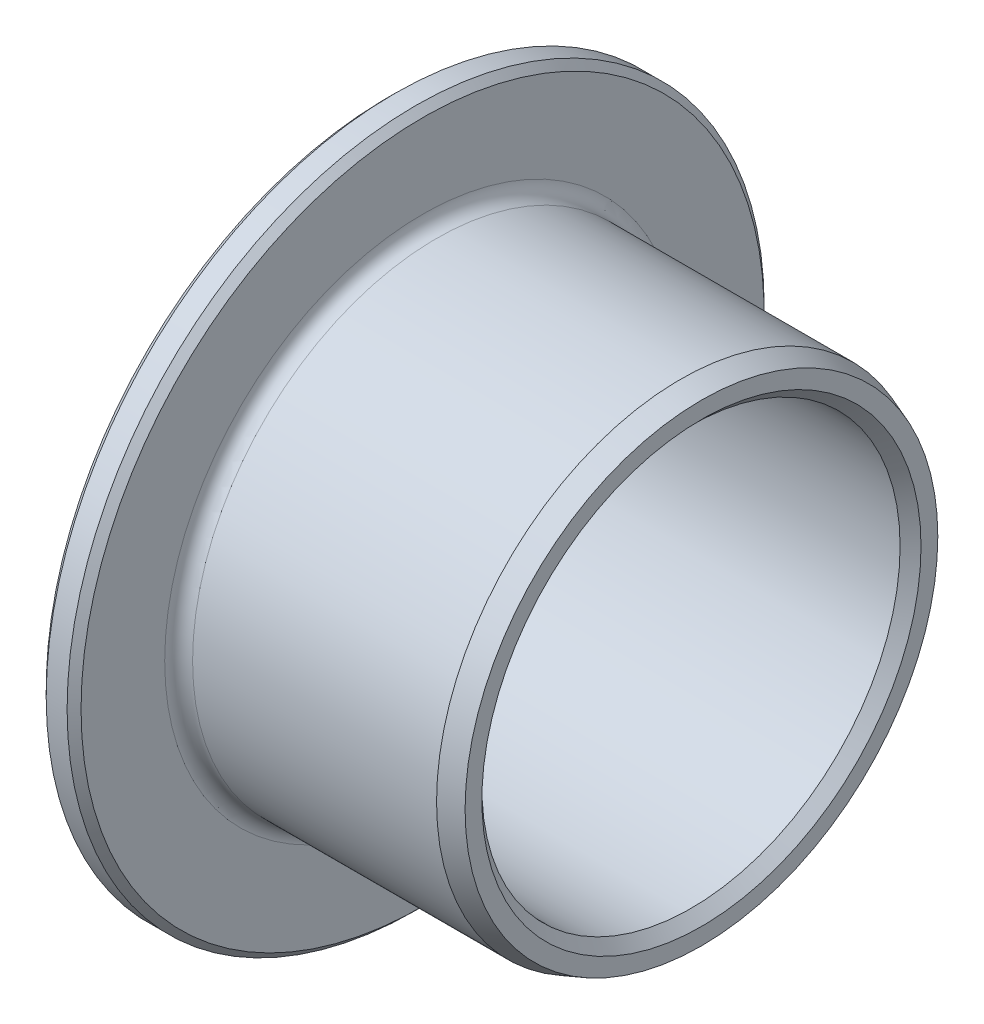
from build123d import *

# Parameters (mm, degrees)
CHANFREIN2_SIZE  = 0.6
CHANFREIN2_SIZE2 = 0.218382141
CHANFREIN3_SIZE  = 0.3
CHANFREIN4_SIZE  = 0.2
CONG_1_R         = 0.4


with BuildPart() as part:
    # Esquisse1 → Base-Révolution (revolve)
    with BuildSketch(Plane.XY, mode=Mode.PRIVATE) as base_r_volution_sk:
        Polygon((-1, 6), (-1, 10), (0, 10), (0, 7), (8, 7), (8, 6), align=None)
    revolve(base_r_volution_sk.sketch.rotate(Axis((-5.312682662, 0, 0), (1, 0, 0)), 90), axis=Axis((-5.312682662, 0, 0), (1, 0, 0)))

    # Chanfrein2
    chanfrein2_edges = [part.edges().sort_by_distance(p)[0] for p in [
        (8, 0, -7),
    ]]
    chanfrein2_side = [part.faces().sort_by_distance(p)[0] for p in [
        (4, 0, -7),
    ]]
    chamfer(chanfrein2_edges, length=CHANFREIN2_SIZE, length2=CHANFREIN2_SIZE2, reference=chanfrein2_side[0])

    # Chanfrein3
    chanfrein3_edges = [part.edges().sort_by_distance(p)[0] for p in [
        (-1, 0, -6),
        (8, 0, -6),
    ]]
    chamfer(chanfrein3_edges, length=CHANFREIN3_SIZE)

    # Chanfrein4
    chanfrein4_edges = [part.edges().sort_by_distance(p)[0] for p in [
        (0, 0, -10),
        (-1, 0, -10),
    ]]
    chamfer(chanfrein4_edges, length=CHANFREIN4_SIZE)

    # Congé1
    cong_1_edges = [part.edges().sort_by_distance(p)[0] for p in [
        (0, 0, -7),
    ]]
    fillet(cong_1_edges, radius=CONG_1_R)


solid = part.part
